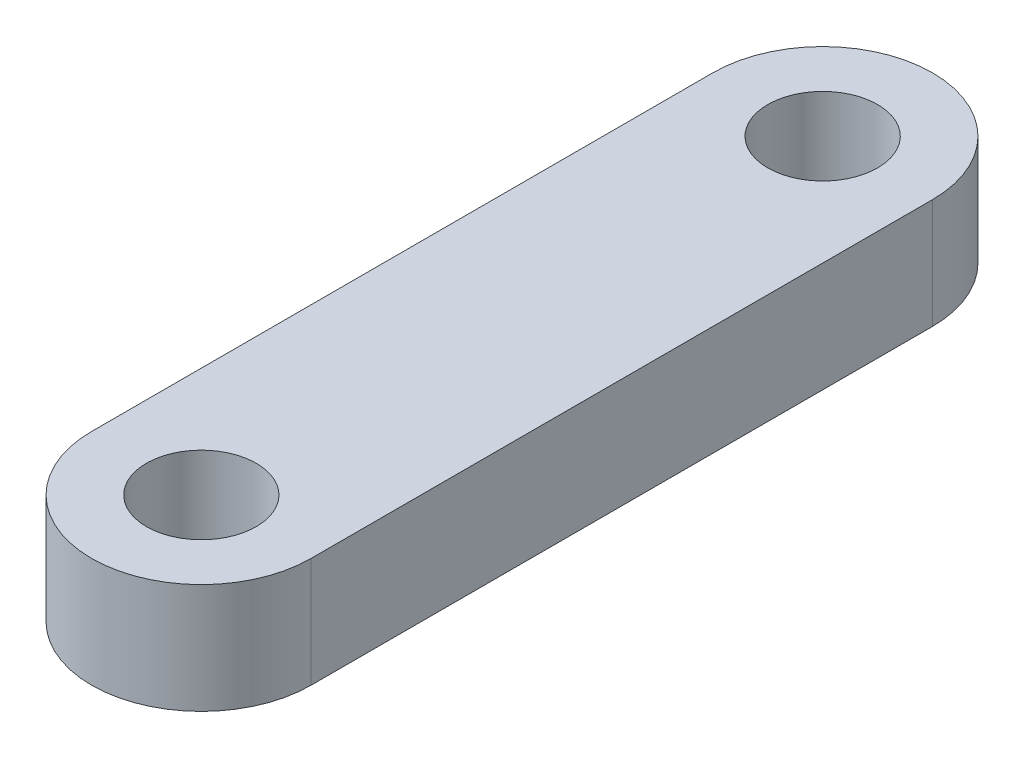
from build123d import *

# Parameters (mm, degrees)
BOSS_EXTRUDE1_DEPTH = 5
SKETCH2_R           = 2.5
CUT_EXTRUDE1_DEPTH  = 21.406404786


with BuildPart() as part:
    # Sketch1 → Boss-Extrude1 (new body)
    with BuildSketch(Plane(origin=(0, 0, 0), x_dir=(1, 0, 0), z_dir=(0, 1, 0))):
        with BuildLine():
            Line((-5, -14.142135625), (-5, 14.142135625))
            ThreePointArc((-5, 14.142135625), (0, 19.142135625), (5, 14.142135625))
            Line((5, 14.142135625), (5, -14.142135625))
            ThreePointArc((5, -14.142135625), (0, -19.142135625), (-5, -14.142135625))
        make_face()
    extrude(amount=BOSS_EXTRUDE1_DEPTH)

    # Sketch2 → Cut-Extrude1 (cut, through all)
    with BuildSketch(Plane(origin=(0, 5, 0), x_dir=(1, 0, 0), z_dir=(0, 1, 0))):
        with Locations(Location((0, 14.142135625, 0), (0, 0, 270))):
            Circle(SKETCH2_R)
        with Locations(Location((0, -14.142135625, 0), (0, 0, 270))):
            Circle(SKETCH2_R)
    extrude(amount=-CUT_EXTRUDE1_DEPTH, mode=Mode.SUBTRACT)


solid = part.part
